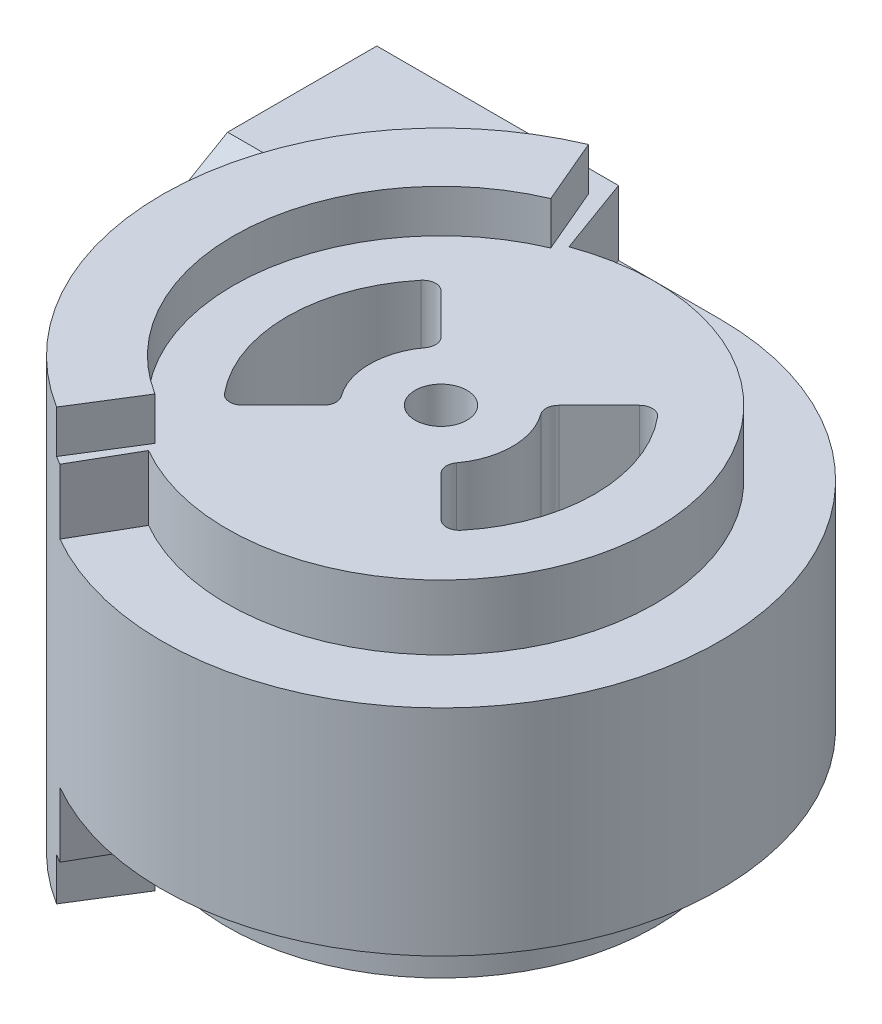
from build123d import *

# Parameters (mm, degrees)
SKETCH1_R           = 4
BOSS_EXTRUDE1_DEPTH = 26.56
CUT_EXTRUDE1_START  = -10
CUT_EXTRUDE1_DEPTH  = 10
BOSS_EXTRUDE2_DEPTH = 6.6
CUT_EXTRUDE2_DEPTH  = 10
SKETCH4_R           = 21
CUT_EXTRUDE3_DEPTH  = 20
SKETCH5_W           = 37.244501106
SKETCH5_H           = 28
BOSS_EXTRUDE3_DEPTH = 1.5
SKETCH7_R           = 4


with BuildPart() as part:
    # Sketch1 → Boss-Extrude1 (new body)
    with BuildSketch(Plane(origin=(0, 0, 0), x_dir=(1, 0, 0), z_dir=(0, 1, 0))):
        with BuildLine():
            Line((0, 43), (-52.895221179, 43))
            Line((-52.895221179, 43), (-52.895221179, -3))
            Line((-52.895221179, -3), (-42.895221179, -3))
            ThreePointArc((-42.895221179, -3), (31.448370387, -29.325756597), (0, 43))
        make_face()
        with Locations(Location((0, 0, 0), (0, 0, 90))):
            Circle(SKETCH1_R, mode=Mode.SUBTRACT)
        with BuildLine():
            Line((-15.278907029, -15.278907029), (-9.082951062, -9.082951062))
            ThreePointArc((-9.082951062, -9.082951062), (-8.503126103, -7.8230436), (-8.882216221, -6.488931731))
            ThreePointArc((-8.882216221, -6.488931731), (-11, 0), (-8.882216221, 6.488931731))
            ThreePointArc((-8.882216221, 6.488931731), (-8.503126103, 7.8230436), (-9.082951062, 9.082951062))
            Line((-9.082951062, 9.082951062), (-15.278907029, 15.278907029))
            ThreePointArc((-15.278907029, 15.278907029), (-16.785384719, 15.862564166), (-18.231657051, 15.142545399))
            ThreePointArc((-18.231657051, 15.142545399), (-23.7, 0), (-18.231657051, -15.142545399))
            ThreePointArc((-18.231657051, -15.142545399), (-16.785384719, -15.862564166), (-15.278907029, -15.278907029))
        make_face(mode=Mode.SUBTRACT)
        with BuildLine():
            Line((15.278907029, 15.278907029), (9.082951062, 9.082951062))
            ThreePointArc((9.082951062, 9.082951062), (8.503126103, 7.8230436), (8.882216221, 6.488931731))
            ThreePointArc((8.882216221, 6.488931731), (11, 0), (8.882216221, -6.488931731))
            ThreePointArc((8.882216221, -6.488931731), (8.503126103, -7.8230436), (9.082951062, -9.082951062))
            Line((9.082951062, -9.082951062), (15.278907029, -15.278907029))
            ThreePointArc((15.278907029, -15.278907029), (16.785384719, -15.862564166), (18.231657051, -15.142545399))
            ThreePointArc((18.231657051, -15.142545399), (23.7, 0), (18.231657051, 15.142545399))
            ThreePointArc((18.231657051, 15.142545399), (16.785384719, 15.862564166), (15.278907029, 15.278907029))
        make_face(mode=Mode.SUBTRACT)
    boss_extrude1 = extrude(amount=BOSS_EXTRUDE1_DEPTH)

    # Sketch2 → Cut-Extrude1 (cut)
    with BuildSketch(Plane(origin=(0, 26.56, 0), x_dir=(1, 0, 0), z_dir=(0, 1, 0)).offset(CUT_EXTRUDE1_START)):
        with BuildLine():
            Line((-16.5, -28.578838325), (-21.5, -37.239092363))
            ThreePointArc((-21.5, -37.239092363), (41.53481053, -11.129218939), (0, 43))
            Line((0, 43), (-15.650720073, 43))
            Line((-15.650720073, 43), (-11.28666473, 31.009856486))
            ThreePointArc((-11.28666473, 31.009856486), (32.874425037, -2.876139511), (-16.5, -28.578838325))
        make_face()
    cut_extrude1 = extrude(amount=CUT_EXTRUDE1_DEPTH, mode=Mode.SUBTRACT)

    # Sketch2<3> → Boss-Extrude2 (add)
    with BuildSketch(Plane(origin=(0, 26.56, 0), x_dir=(1, 0, 0), z_dir=(0, 1, 0))):
        with BuildLine():
            ThreePointArc((-42.895221179, -3), (-36.85807218, -22.146839847), (-22.786528362, -36.466068135))
            Line((-22.786528362, -36.466068135), (-16.957416455, -27.137539077))
            ThreePointArc((-16.957416455, -27.137539077), (-31.902604506, 2.494759659), (-12.532809858, 29.443652577))
            Line((-12.532809858, 29.443652577), (-16.840963246, 39.56490815))
            ThreePointArc((-16.840963246, 39.56490815), (-36.674865833, 22.448924609), (-42.895221179, -3))
        make_face()
    boss_extrude2 = extrude(amount=BOSS_EXTRUDE2_DEPTH)

    # Mirror1: Boss-Extrude1, Cut-Extrude1, Boss-Extrude2 across plane
    add(boss_extrude1.mirror(Plane.ZX))
    add(cut_extrude1.mirror(Plane.ZX), mode=Mode.SUBTRACT)
    add(boss_extrude2.mirror(Plane.ZX))

    # Sketch3 → Cut-Extrude2 (cut)
    with BuildSketch(Plane.ZY.offset(52.895221179)):
        Polygon((-19.982907976, 26.548244298), (3, 13.279056191), (3, 26.56), (-20.003269449, 26.56), (-20, 26.558112383), align=None)
        Polygon((3, -26.56), (3, -13.279056191), (-20, -26.558112383), (-20.003269449, -26.56), align=None)
    extrude(amount=-CUT_EXTRUDE2_DEPTH, mode=Mode.SUBTRACT)

    # Sketch4 → Cut-Extrude3 (cut)
    with BuildSketch(Plane.ZY.offset(52.895221179)):
        with Locations((-20, 0)):
            Circle(SKETCH4_R)
    extrude(amount=-CUT_EXTRUDE3_DEPTH, mode=Mode.SUBTRACT)

    # Sketch5 → Boss-Extrude3 (add)
    with BuildSketch(Plane(origin=(0, 0, -43), x_dir=(-1, 0, 0), z_dir=(0, 0, -1))):
        with Locations((34.272970626, 0)):
            Rectangle(SKETCH5_W, SKETCH5_H)
    extrude(amount=BOSS_EXTRUDE3_DEPTH)

    # Cut-Sweep3: sweep along a path in Sketch6
    with BuildLine(Plane(origin=(0, 0, 0), x_dir=(1, 0, 0), z_dir=(0, 1, 0))) as cut_sweep3_path:
        Line((-52.895221179, 20), (-32.895221179, 20))
        ThreePointArc((-32.895221179, 20), (-24.409939805, 23.514718626), (-20.895221179, 32))
        Line((-20.895221179, 32), (-20.895221179, 44.5))
    # Sketch7 → Cut-Sweep3 (sweep, cut)
    with BuildSketch(Plane(origin=(0, 0, -44.5), x_dir=(-1, 0, 0), z_dir=(0, 0, -1))):
        with Locations((20.895221179, 0)):
            Circle(SKETCH7_R)
    sweep(path=cut_sweep3_path.line, mode=Mode.SUBTRACT)


solid = part.part
